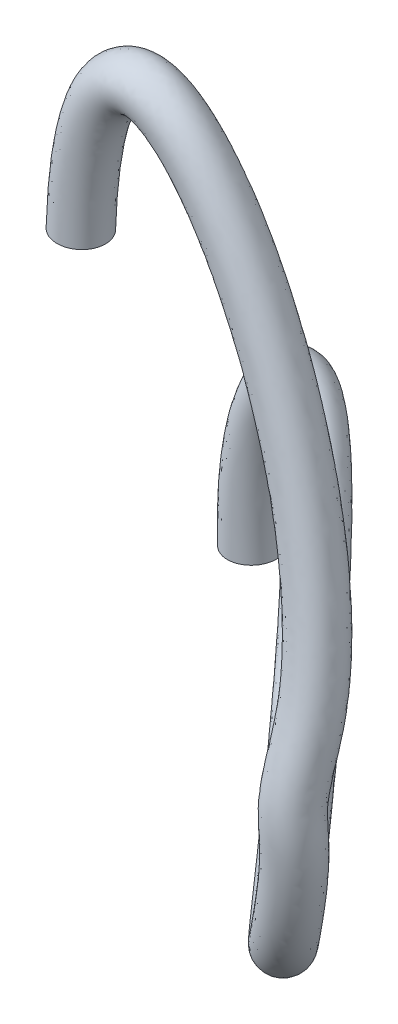
from build123d import *

# Parameters (mm, degrees)
SWEEP1_PROFILE_R = 1


with BuildPart() as part:
    # Sweep1: sweep along a curve in space
    with BuildLine() as sweep1_path:
        add(Edge.make_bspline(
            [(-13.034794242, -226.512822725, 50.124401632), (-13.108276471, -221.597772037, 50.20873687), (-8.457720505, -213.646301254, 49.414748273), (5.622657423, -228.47278003, 68.718876559), (8.3806751, -216.991623457, 69.691589116), (8.08796509, -215.026725213, 69.803625622), (8.813338965, -205.803841532, 66.320883125), (-1.975196898, -185.837464477, 67.635013404), (-2.463758516, -201.319347137, 67.669483948)],
            knots=[0, 0, 0, 0, 0.110506346, 0.429031149, 0.469068496, 0.506234116, 0.559791837, 1, 1, 1, 1], degree=3))
    # Sweep1 profile (on start of the path) → Sweep1 (sweep)
    with BuildSketch(Plane(origin=(-13.034794242, -226.512822725, 50.124401632), x_dir=(0, -0.01715604396711434, 0.9998528242473482), z_dir=(-0.014946581808143426, 0.9997411342947877, 0.017154127527324058))):
        Circle(SWEEP1_PROFILE_R)
    sweep(path=sweep1_path.line)


solid = part.part
